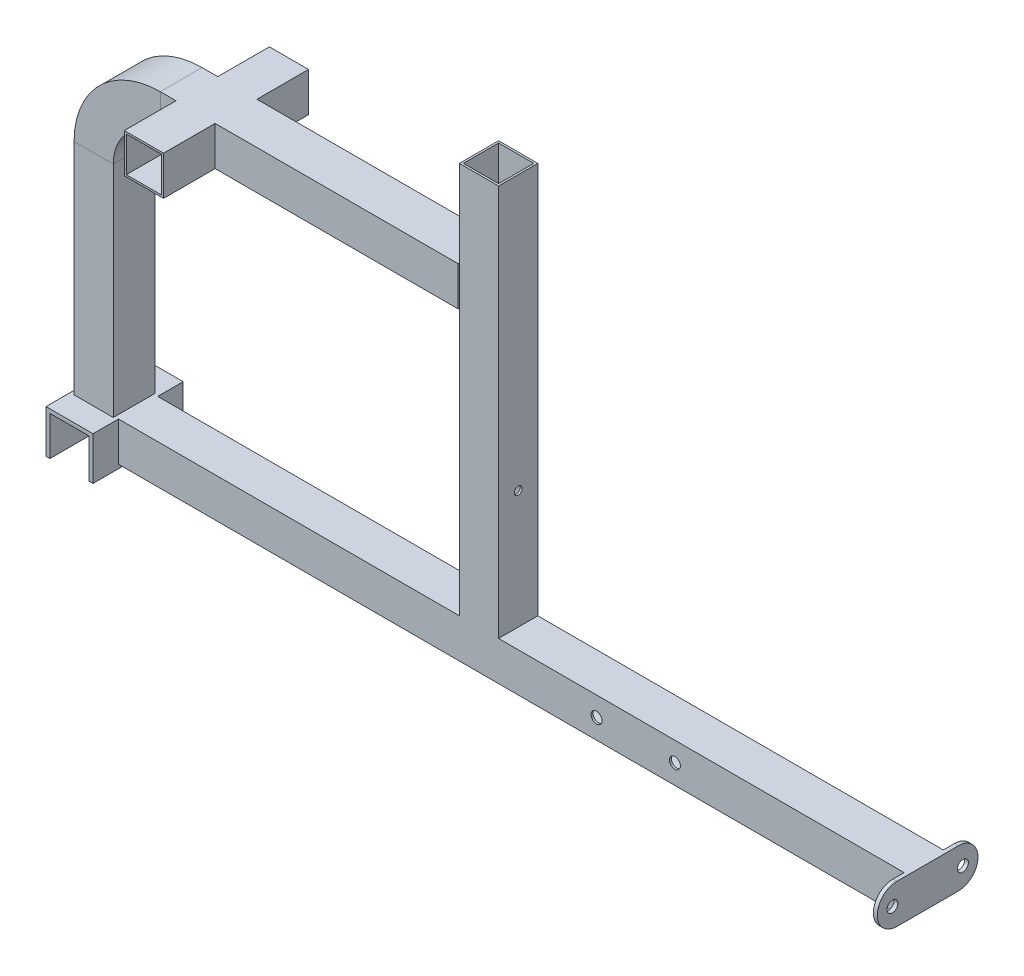
from build123d import *

# Parameters (mm, degrees)
SKETCH3_W               = 50
SKETCH3_H               = 53.36450452
SKETCH3_W_2             = 45
SKETCH3_H_2             = 48.028054068
SKETCH6_W               = 50
SKETCH6_H               = 50
SKETCH6_W_2             = 45
SKETCH6_H_2             = 45
BOSS_EXTRUDE1_DEPTH     = 67.5
SKETCH8_W               = 50
SKETCH8_H               = 50
SKETCH8_W_2             = 45
SKETCH8_H_2             = 45
BOSS_EXTRUDE2_DEPTH     = 500
CUT_EXTRUDE1_DEPTH      = 728.345344386
CUT_EXTRUDE1_DEPTH_BACK = 728.345344386
SKETCH9_W               = 45
SKETCH9_H               = 45
SKETCH12_W              = 60
SKETCH12_H              = 115
SKETCH12_W_2            = 45
SKETCH12_H_2            = 48.028054068
BOSS_EXTRUDE6_DEPTH     = 5
SKETCH14_W              = 115
SKETCH14_H              = 55
BOSS_EXTRUDE7_DEPTH     = 5
SKETCH15_W              = 50
SKETCH15_H              = 50
SKETCH15_W_2            = 45
SKETCH15_H_2            = 45
BOSS_EXTRUDE8_DEPTH     = 1005
CUT_EXTRUDE3_DEPTH      = 1156.435523948
CUT_EXTRUDE3_DEPTH_BACK = 1156.435523948
SKETCH18_R              = 7
SKETCH19_R              = 7
BOSS_EXTRUDE9_DEPTH     = 2.5
CUT_EXTRUDE4_REACH      = 747.373
SKETCH20_R              = 5


with BuildPart() as part:
    # Sweep1: sweep along a path in Sketch1
    with BuildLine(Plane.XY) as sweep1_path:
        Line((0, 0), (0, 280))
        ThreePointArc((0, 280), (24.895923599, 340.104076401), (85, 365))
        Line((85, 365), (465, 365))
    # Sketch3 → Sweep1 (sweep)
    with BuildSketch(Plane(origin=(0, 0, 0), x_dir=(1, 0, 0), z_dir=(0, 1, 0))):
        Rectangle(SKETCH3_W, SKETCH3_H)
        Rectangle(SKETCH3_W_2, SKETCH3_H_2, mode=Mode.SUBTRACT)
    sweep(path=sweep1_path.line)

    # Sketch6 → Boss-Extrude1 (add)
    with BuildSketch(Plane.XY.offset(-25)):
        with Locations((130, 365)):
            Rectangle(SKETCH6_W, SKETCH6_H)
        with Locations((130, 365)):
            Rectangle(SKETCH6_W_2, SKETCH6_H_2, mode=Mode.SUBTRACT)
    boss_extrude1 = extrude(amount=-BOSS_EXTRUDE1_DEPTH)

    # Mirror1: Boss-Extrude1 across plane
    add(boss_extrude1.mirror(Plane.XY))

    # Sketch8 → Boss-Extrude2 (add)
    with BuildSketch(Plane(origin=(0, 0, 0), x_dir=(1, 0, 0), z_dir=(0, 1, 0))):
        with Locations((490, 0)):
            Rectangle(SKETCH8_W, SKETCH8_H)
        with Locations((490, 0)):
            Rectangle(SKETCH8_W_2, SKETCH8_H_2, mode=Mode.SUBTRACT)
    extrude(amount=BOSS_EXTRUDE2_DEPTH)

    # Sketch9 → Cut-Extrude1 (cut, two sides: drawn at the far end of the back side and taken through both)
    with BuildSketch(Plane.XY.offset(25).offset(-CUT_EXTRUDE1_DEPTH_BACK)):
        with Locations((130, 365)):
            Rectangle(SKETCH9_W, SKETCH9_H)
    extrude(amount=CUT_EXTRUDE1_DEPTH + CUT_EXTRUDE1_DEPTH_BACK, mode=Mode.SUBTRACT)

    # Sketch12 → Boss-Extrude6 (add)
    with BuildSketch(Plane(origin=(0, 0, 0), x_dir=(1, 0, 0), z_dir=(0, 1, 0))):
        Rectangle(SKETCH12_W, SKETCH12_H)
        Rectangle(SKETCH12_W_2, SKETCH12_H_2, mode=Mode.SUBTRACT)
    extrude(amount=-BOSS_EXTRUDE6_DEPTH)

    # Sketch14 → Boss-Extrude7 (add)
    with BuildSketch(Plane(origin=(-25, 0, 0), x_dir=(0, 0, -1), z_dir=(1, 0, 0))):
        with Locations((0, -27.5)):
            Rectangle(SKETCH14_W, SKETCH14_H)
    boss_extrude7 = extrude(amount=-BOSS_EXTRUDE7_DEPTH)

    # Mirror2: Boss-Extrude7 across plane
    add(boss_extrude7.mirror(Plane(origin=(0, 0, 0), x_dir=(0, 0, 1), z_dir=(1, 0, 0))))

    # Sketch15 → Boss-Extrude8 (add)
    with BuildSketch(Plane(origin=(30, 0, 0), x_dir=(0, 0, -1), z_dir=(1, 0, 0))):
        with Locations((0, -25)):
            Rectangle(SKETCH15_W, SKETCH15_H)
        with Locations((0, -25.38965636)):
            Rectangle(SKETCH15_W_2, SKETCH15_H_2, mode=Mode.SUBTRACT)
    extrude(amount=BOSS_EXTRUDE8_DEPTH)

    # Sketch18 → Cut-Extrude3 (cut, two sides: drawn at the far end of the back side and taken through both)
    with BuildSketch(Plane.XY.offset(25).offset(-CUT_EXTRUDE3_DEPTH_BACK)):
        with Locations(Location((640, -25, 0), (0, 0, 180))):
            Circle(SKETCH18_R)
        with Locations(Location((740, -25, 0), (0, 0, 180))):
            Circle(SKETCH18_R)
    extrude(amount=CUT_EXTRUDE3_DEPTH + CUT_EXTRUDE3_DEPTH_BACK, mode=Mode.SUBTRACT)

    # Sketch19 → Boss-Extrude9 (add, symmetric)
    # profile 1 of 2: a face of its own
    with BuildSketch(Plane(origin=(1035, 0, 0), x_dir=(0, 0, -1), z_dir=(1, 0, 0))):
        with BuildLine():
            Line((25, -50), (25, 0))
            Line((25, 0), (-25, 0))
            Line((-25, 0), (-26.68225226, 0))
            Line((-26.68225226, 0), (-39.279697572, 0))
            ThreePointArc((-39.279697572, 0), (-64.246269333, -24.966571761), (-39.279697572, -49.933143522))
            Line((-39.279697572, -49.933143522), (-25, -50))
            Line((-25, -50), (25, -50))
        make_face()
        with Locations((-45, -24.966571761)):
            Circle(SKETCH19_R, mode=Mode.SUBTRACT)
    # profile 2 of 2: a face of its own
    with BuildSketch(Plane(origin=(1035, 0, 0), x_dir=(0, 0, -1), z_dir=(1, 0, 0))):
        with BuildLine():
            Line((26.420207217, 0), (25, 0))
            Line((25, 0), (25, -50))
            Line((25, -50), (39.279697572, -49.933143522))
            ThreePointArc((39.279697572, -49.933143522), (64.246269333, -24.966571761), (39.279697572, 0))
            Line((39.279697572, 0), (26.68225226, 0))
            Line((26.68225226, 0), (26.420207217, 0))
        make_face()
        with Locations((45, -24.966571761)):
            Circle(SKETCH19_R, mode=Mode.SUBTRACT)
    extrude(amount=BOSS_EXTRUDE9_DEPTH, both=True)

    # Cut-Extrude4: up to this face of the body (flat: up to its plane)
    cut_extrude4_end = Plane(part.part.faces().sort_by_distance((465, 170, 0))[0])
    # Sketch20 → Cut-Extrude4 (cut, up to the picked face)
    with BuildSketch(Plane(origin=(515, 0, 0), x_dir=(0, 0, -1), z_dir=(1, 0, 0)), mode=Mode.PRIVATE) as cut_extrude4_sk1:
        with Locations((0, 150.748695463)):
            Circle(SKETCH20_R)
    cut_extrude4_tool1 = split(extrude(cut_extrude4_sk1.sketch, amount=-CUT_EXTRUDE4_REACH, mode=Mode.PRIVATE), bisect_by=cut_extrude4_end, keep=Keep.BOTH, mode=Mode.PRIVATE)
    add(cut_extrude4_tool1.solids().sort_by(Axis((515, 150.748695, 0), (-1, 0, 0)))[0], mode=Mode.SUBTRACT)


solid = part.part
